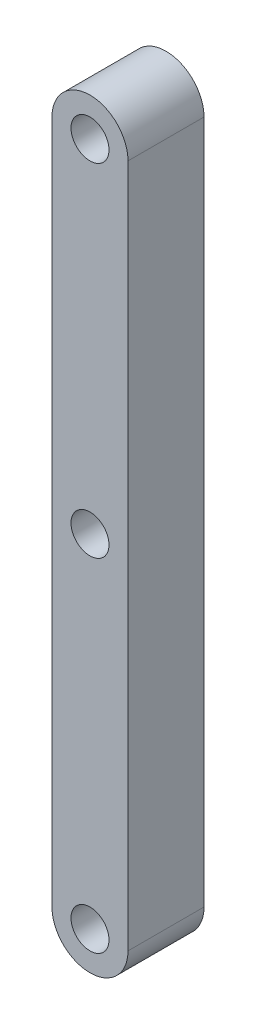
from build123d import *

# Parameters (mm, degrees)
EXTRUDE_1_DEPTH     = 10
SKETCH_3_R          = 2.5
CUT_EXTRUDE_1_DEPTH = 10
SKETCH_4_R          = 2.5
CUT_EXTRUDE_2_DEPTH = 10
SKETCH_5_R          = 2.5
CUT_EXTRUDE_3_DEPTH = 10


with BuildPart() as part:
    # 草图1 → 凸台-拉伸1 (new body)
    with BuildSketch(Plane.XY):
        with BuildLine():
            Line((-5, 0), (-5, 90))
            ThreePointArc((-5, 90), (0, 95), (5, 90))
            Line((5, 90), (5, 0))
            ThreePointArc((5, 0), (0, -5), (-5, 0))
        make_face()
    extrude(amount=EXTRUDE_1_DEPTH)

    # 草图3 → 切除-拉伸1 (cut)
    with BuildSketch(Plane(origin=(0, 0, 0), x_dir=(-1, 0, 0), z_dir=(0, 0, -1))):
        with Locations((0, 45)):
            Circle(SKETCH_3_R)
    extrude(amount=-CUT_EXTRUDE_1_DEPTH, mode=Mode.SUBTRACT)

    # 草图4 → 切除-拉伸2 (cut)
    with BuildSketch(Plane.XY.offset(10)):
        with Locations((0, 90)):
            Circle(SKETCH_4_R)
    extrude(amount=-CUT_EXTRUDE_2_DEPTH, mode=Mode.SUBTRACT)

    # 草图5 → 切除-拉伸3 (cut)
    with BuildSketch(Plane.XY.offset(10)):
        Circle(SKETCH_5_R)
    extrude(amount=-CUT_EXTRUDE_3_DEPTH, mode=Mode.SUBTRACT)


solid = part.part
